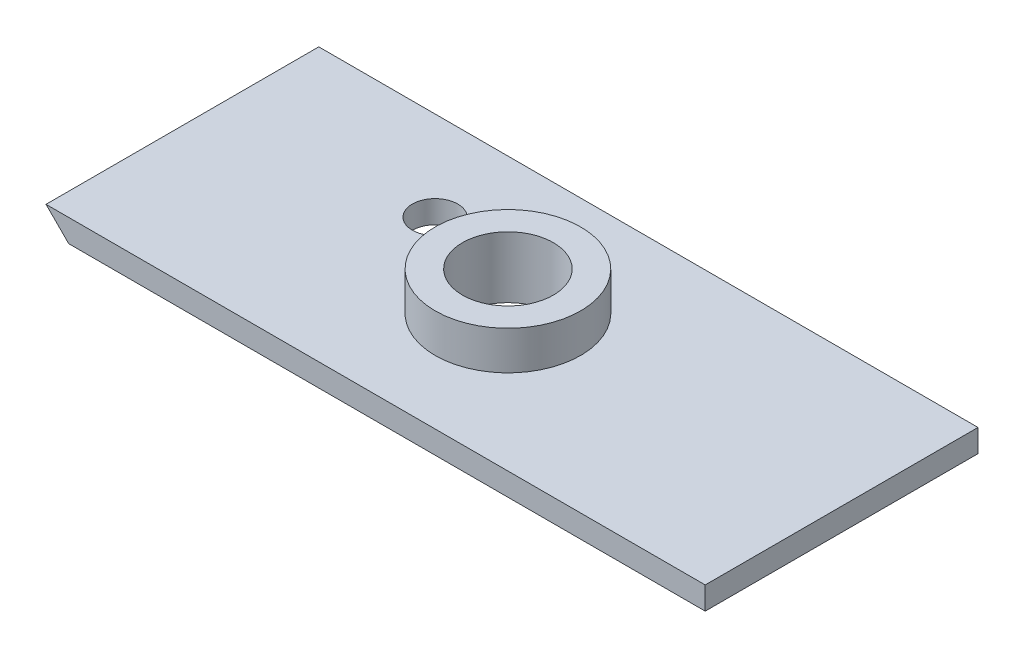
from build123d import *

# Parameters (mm, degrees)
SKETCH_2_W          = 30
SKETCH_2_H          = 12
SKETCH_2_R          = 2
EXTRUDE_1_DEPTH     = 1
SKETCH_3_R          = 3.2
SKETCH_3_R_2        = 2
EXTRUDE_2_DEPTH     = 1.7
SKETCH_4_R          = 1
CUT_EXTRUDE_1_DEPTH = 5
EXTRUDE_3_DEPTH     = 12
SKETCH_6_W          = 2
SKETCH_6_H          = 12
CUT_EXTRUDE_2_DEPTH = 1


with BuildPart() as part:
    # 草图2 → 凸台-拉伸1 (new body)
    with BuildSketch(Plane(origin=(0, 0, 0), x_dir=(1, 0, 0), z_dir=(0, 1, 0))):
        with Locations((-3.527606217, -1.94741871)):
            Rectangle(SKETCH_2_W, SKETCH_2_H)
        with Locations(Location((-5.207606217, -1.94741871, 0), (0, 0, 270))):
            Circle(SKETCH_2_R, mode=Mode.SUBTRACT)
    extrude(amount=EXTRUDE_1_DEPTH)

    # 草图3 → 凸台-拉伸2 (add)
    with BuildSketch(Plane(origin=(0, 1, 0), x_dir=(1, 0, 0), z_dir=(0, 1, 0))):
        with Locations(Location((-5.207606217, -1.94741871, 0), (0, 0, 270))):
            Circle(SKETCH_3_R)
        with Locations(Location((-5.207606217, -1.94741871, 0), (0, 0, 270))):
            Circle(SKETCH_3_R_2, mode=Mode.SUBTRACT)
    extrude(amount=EXTRUDE_2_DEPTH)

    # 草图4 → 切除-拉伸1 (cut)
    with BuildSketch(Plane.XZ):
        with Locations(Location((-10.481209657, -0.12271673, 0), (0, 0, 270))):
            Circle(SKETCH_4_R)
    extrude(amount=-CUT_EXTRUDE_1_DEPTH, mode=Mode.SUBTRACT)

    # 草图5 → 凸台-拉伸3 (add)
    with BuildSketch(Plane(origin=(0, 0, -4.05258129), x_dir=(-1, 0, 0), z_dir=(0, 0, -1))):
        Polygon((18.527606217, 1), (18.527606217, 0), (19.527606217, 1), align=None)
    extrude(amount=-EXTRUDE_3_DEPTH)

    # 草图6 → 切除-拉伸2 (cut)
    with BuildSketch(Plane.XZ):
        with Locations((10.472393783, 1.94741871)):
            Rectangle(SKETCH_6_W, SKETCH_6_H)
    extrude(amount=-CUT_EXTRUDE_2_DEPTH, mode=Mode.SUBTRACT)


solid = part.part
